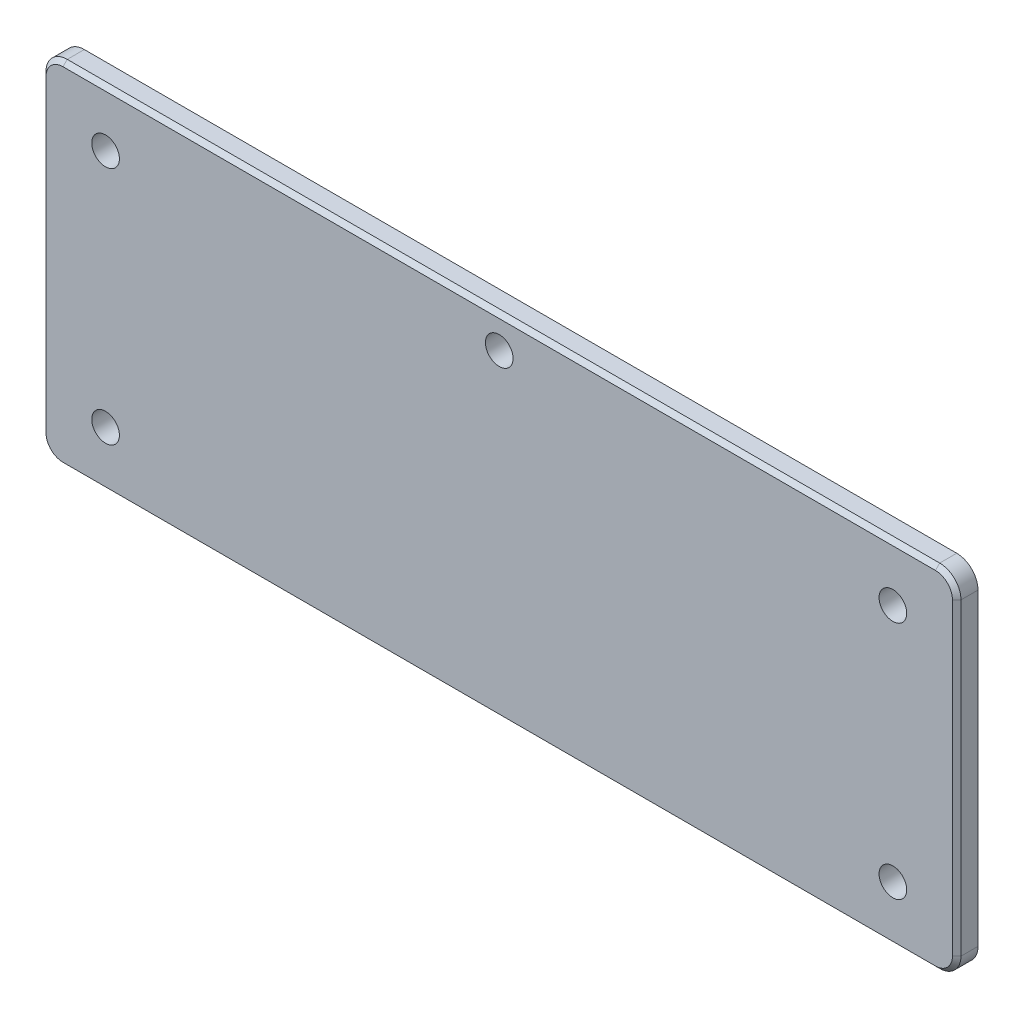
from build123d import *

# Parameters (mm, degrees)
SKETCH1_W               = 109.22
SKETCH1_H               = 41.91
BOSS_EXTRUDE1_DEPTH     = 2.54
CUT_EXTRUDE2_DEPTH      = 59.547550974
CUT_EXTRUDE2_DEPTH_BACK = 59.547550974
SKETCH4_R               = 1.651
FILLET1_R               = 2.54
SKETCH14_R              = 1.651
CUT_EXTRUDE8_DEPTH      = 59.547550974
CHAMFER2_SIZE           = 0.508


with BuildPart() as part:
    # Sketch1 → Boss-Extrude1 (new body)
    with BuildSketch(Plane.XY):
        Rectangle(SKETCH1_W, SKETCH1_H)
    extrude(amount=BOSS_EXTRUDE1_DEPTH)

    # Sketch4 → Cut-Extrude2 (cut, two sides: drawn at the far end of the back side and taken through both)
    with BuildSketch(Plane.XY.offset(2.54).offset(-CUT_EXTRUDE2_DEPTH_BACK)):
        with Locations((-46.99, 14.2875)):
            Circle(SKETCH4_R)
        with Locations((-46.99, -14.2875)):
            Circle(SKETCH4_R)
        with Locations((46.99, -14.2875)):
            Circle(SKETCH4_R)
        with Locations((46.99, 14.2875)):
            Circle(SKETCH4_R)
    extrude(amount=CUT_EXTRUDE2_DEPTH + CUT_EXTRUDE2_DEPTH_BACK, mode=Mode.SUBTRACT)

    # Fillet1
    fillet1_edges = [part.edges().sort_by_distance(p)[0] for p in [
        (-54.61, 20.955, 1.27),
        (54.61, 20.955, 1.27),
        (54.61, -20.955, 1.27),
        (-54.61, -20.955, 1.27),
    ]]
    fillet(fillet1_edges, radius=FILLET1_R)

    # Sketch14 → Cut-Extrude8 (cut, through all)
    with BuildSketch(Plane.XY.offset(2.54)):
        with Locations((0, 17.145)):
            Circle(SKETCH14_R)
    extrude(amount=-CUT_EXTRUDE8_DEPTH, mode=Mode.SUBTRACT)

    # Chamfer2
    chamfer2_edges = [part.edges().sort_by_distance(p)[0] for p in [
        (0, 20.955, 2.54),
        (54.61, 0, 2.54),
        (-54.61, 0, 2.54),
        (0, -20.955, 2.54),
        (-53.866051224, 20.211051224, 2.54),
        (-53.866051224, -20.211051224, 2.54),
        (53.866051224, -20.211051224, 2.54),
        (53.866051224, 20.211051224, 2.54),
    ]]
    chamfer(chamfer2_edges, length=CHAMFER2_SIZE)


solid = part.part
